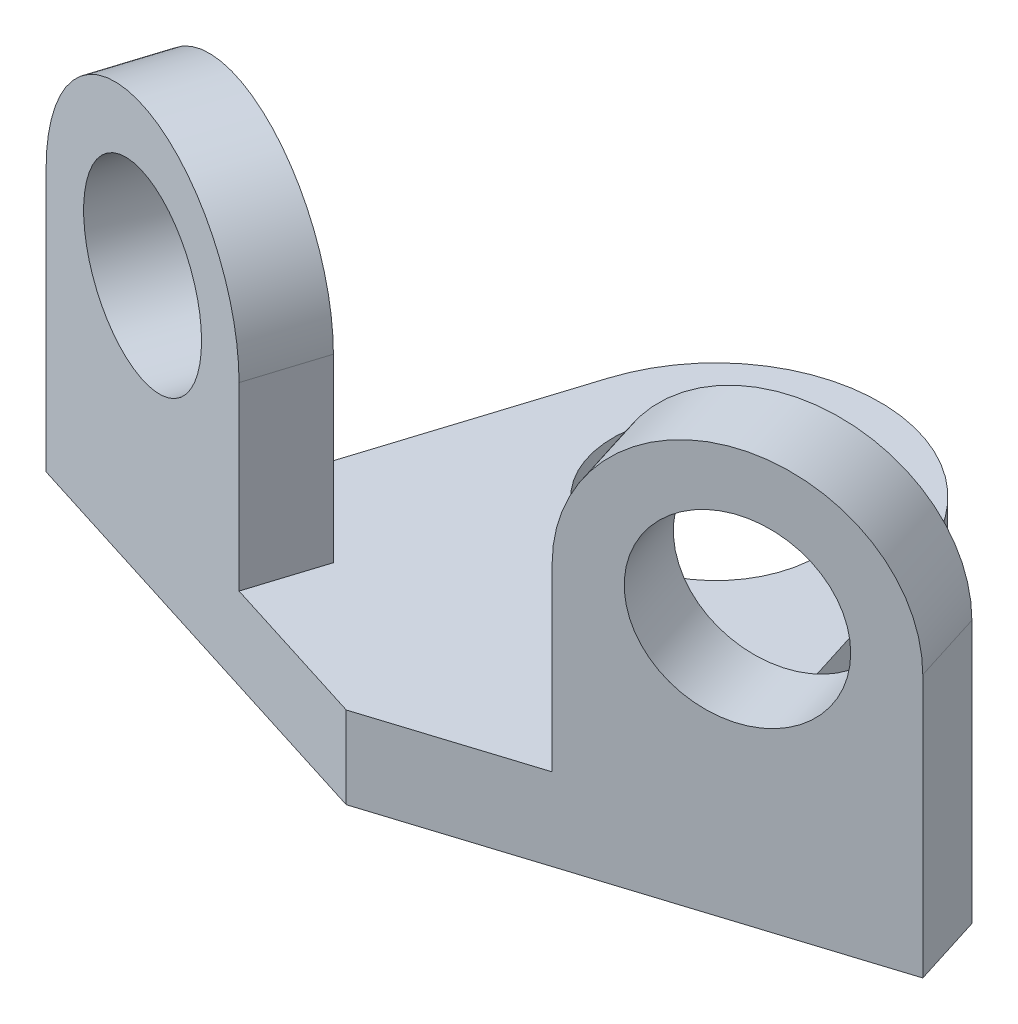
from build123d import *

# Parameters (mm, degrees)
SKETCH2_R           = 12.5
BOSS_EXTRUDE1_DEPTH = 10
BOSS_EXTRUDE2_DEPTH = 50
SKETCH5_R           = 11
CUT_EXTRUDE3_DEPTH  = 20
SKETCH3_R           = 11
CUT_EXTRUDE4_DEPTH  = 20


with BuildPart() as part:
    # Sketch2 → Boss-Extrude1 (new body)
    with BuildSketch(Plane(origin=(0, 0, 0), x_dir=(1, 0, 0), z_dir=(0, 1, 0))):
        with BuildLine():
            Line((-19.074339015, 6.01411599), (0, 0))
            Line((0, 0), (19.074339015, 6.01411599))
            Line((19.074339015, 6.01411599), (16.318990173, 14.752966055))
            Line((16.318990173, 14.752966055), (29.197895289, 18.81366924))
            Line((29.197895289, 18.81366924), (19.498961292, 49.574757892))
            ThreePointArc((19.498961292, 49.574757892), (0.775540523, 64.986060166), (-19.045136415, 51.014106515))
            Line((-19.045136415, 51.014106515), (-29.197895289, 18.81366924))
            Line((-29.197895289, 18.81366924), (-16.318990173, 14.752966055))
            Line((-16.318990173, 14.752966055), (-19.074339015, 6.01411599))
        make_face()
        with Locations((0.0292026, 44.999990525)):
            Circle(SKETCH2_R, mode=Mode.SUBTRACT)
    extrude(amount=BOSS_EXTRUDE1_DEPTH)

    # Sketch2<4> → Boss-Extrude2 (add)
    with BuildSketch(Plane(origin=(0, 0, 0), x_dir=(1, 0, 0), z_dir=(0, 1, 0))):
        Polygon((16.318990173, 14.752966055), (19.074339015, 6.01411599), (53.408149242, 16.839524772), (50.6528004, 25.578374837), align=None)
        Polygon((-53.408149242, 16.839524772), (-19.074339015, 6.01411599), (-16.318990173, 14.752966055), (-50.6528004, 25.578374837), align=None)
    extrude(amount=BOSS_EXTRUDE2_DEPTH)

    # Sketch5 → Cut-Extrude3 (cut)
    with BuildSketch(Plane(origin=(0, 0, 0), x_dir=(0.9537169507482267, 0, -0.30070579950427406), z_dir=(0.300705799504274, 0, 0.9537169507482266))):
        with Locations((38, 32)):
            Circle(SKETCH5_R)
        with BuildLine():
            ThreePointArc((20, 32), (25.272077939, 44.727922061), (38, 50))
            Line((38, 50), (20, 50))
            Line((20, 50), (20, 32))
        make_face()
        with BuildLine():
            ThreePointArc((38, 50), (50.727922061, 44.727922061), (56, 32))
            Line((56, 32), (56, 50))
            Line((56, 50), (38, 50))
        make_face()
    extrude(amount=-CUT_EXTRUDE3_DEPTH, mode=Mode.SUBTRACT)

    # Sketch3 → Cut-Extrude4 (cut)
    with BuildSketch(Plane(origin=(0, 0, 0), x_dir=(0.9537169507482267, 0, 0.30070579950427406), z_dir=(-0.300705799504274, 0, 0.9537169507482266))):
        with BuildLine():
            ThreePointArc((-38, 50), (-25.272077939, 44.727922061), (-20, 32))
            Line((-20, 32), (-20, 50))
            Line((-20, 50), (-38, 50))
        make_face()
        with Locations((-38, 32)):
            Circle(SKETCH3_R)
        with BuildLine():
            ThreePointArc((-56, 32), (-50.727922061, 44.727922061), (-38, 50))
            Line((-38, 50), (-56, 50))
            Line((-56, 50), (-56, 32))
        make_face()
    extrude(amount=-CUT_EXTRUDE4_DEPTH, mode=Mode.SUBTRACT)


solid = part.part
